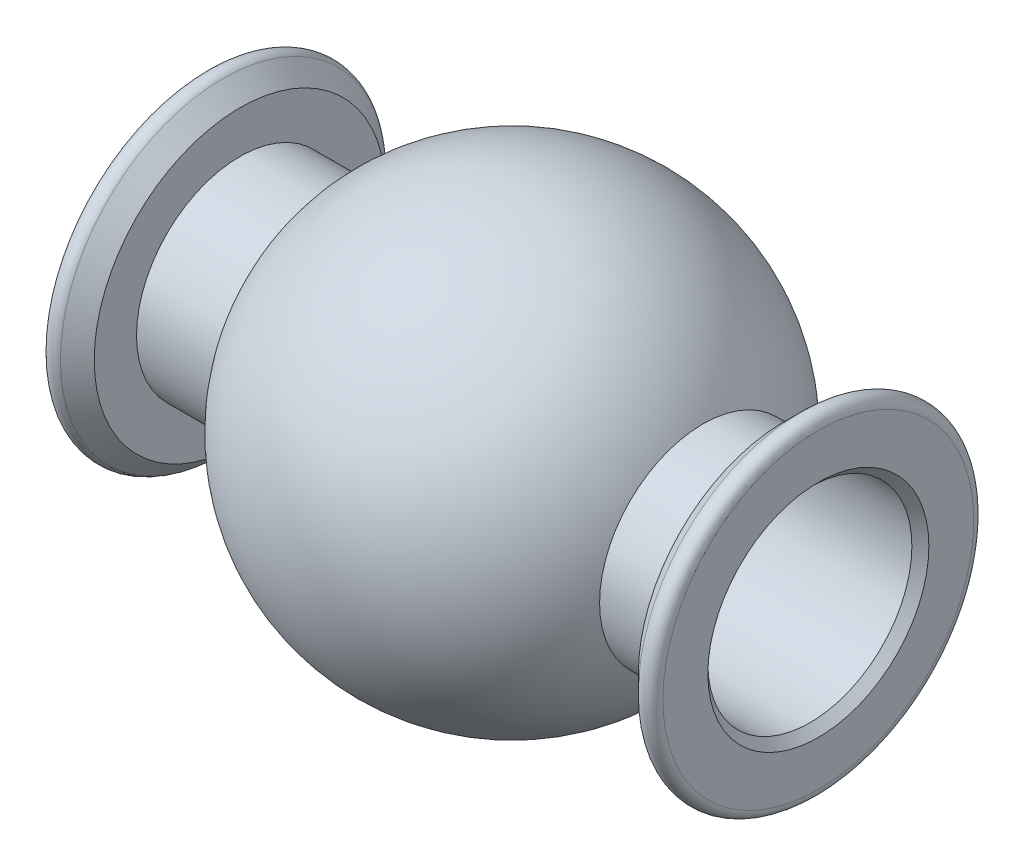
from build123d import *

# Parameters (mm, degrees)
SKETCH3_R          = 3
CUT_EXTRUDE4_DEPTH = 24


with BuildPart() as part:
    # Sketch2 → Revolve2 (revolve)
    with BuildSketch(Plane.XY, mode=Mode.PRIVATE) as revolve2_sk:
        with BuildLine():
            Line((-13.618675666, 15.043449319), (-16, 15.043449319))
            Line((-16, 15.043449319), (-16, 16.285660618))
            Line((-16, 16.285660618), (-16.497212995, 16.782873614))
            ThreePointArc((-16.497212995, 16.782873614), (-16.824150059, 16.847905439), (-17.00934503, 16.570741579))
            Line((-17.00934503, 16.570741579), (-17.00934503, 15.25))
            Line((-17.00934503, 15.25), (-16.504672515, 14.745327485))
            Line((-16.504672515, 14.745327485), (-16.504672515, 12))
            Line((-16.504672515, 12), (0.504672515, 12))
            Line((0.504672515, 12), (0.504672515, 14.745327485))
            Line((0.504672515, 14.745327485), (1.00934503, 15.25))
            Line((1.00934503, 15.25), (1.00934503, 16.570741579))
            ThreePointArc((1.00934503, 16.570741579), (0.824150059, 16.847905439), (0.497212995, 16.782873614))
            Line((0.497212995, 16.782873614), (0, 16.285660618))
            Line((0, 16.285660618), (0, 15.043449319))
            Line((0, 15.043449319), (-2.381324334, 15.043449319))
            ThreePointArc((-2.381324334, 15.043449319), (-8, 18.39), (-13.618675666, 15.043449319))
        make_face()
    revolve(revolve2_sk.sketch.rotate(Axis((-16.504672515, 12, 0), (1, 0, 0)), 90), axis=Axis((-16.504672515, 12, 0), (1, 0, 0)))

    # Sketch3 → Cut-Extrude4 (cut)
    with BuildSketch(Plane(origin=(1.00934503, 0, 0), x_dir=(0, 0, -1), z_dir=(1, 0, 0))):
        with Locations((0, 12)):
            Circle(SKETCH3_R)
    extrude(amount=-CUT_EXTRUDE4_DEPTH, mode=Mode.SUBTRACT)


solid = part.part
